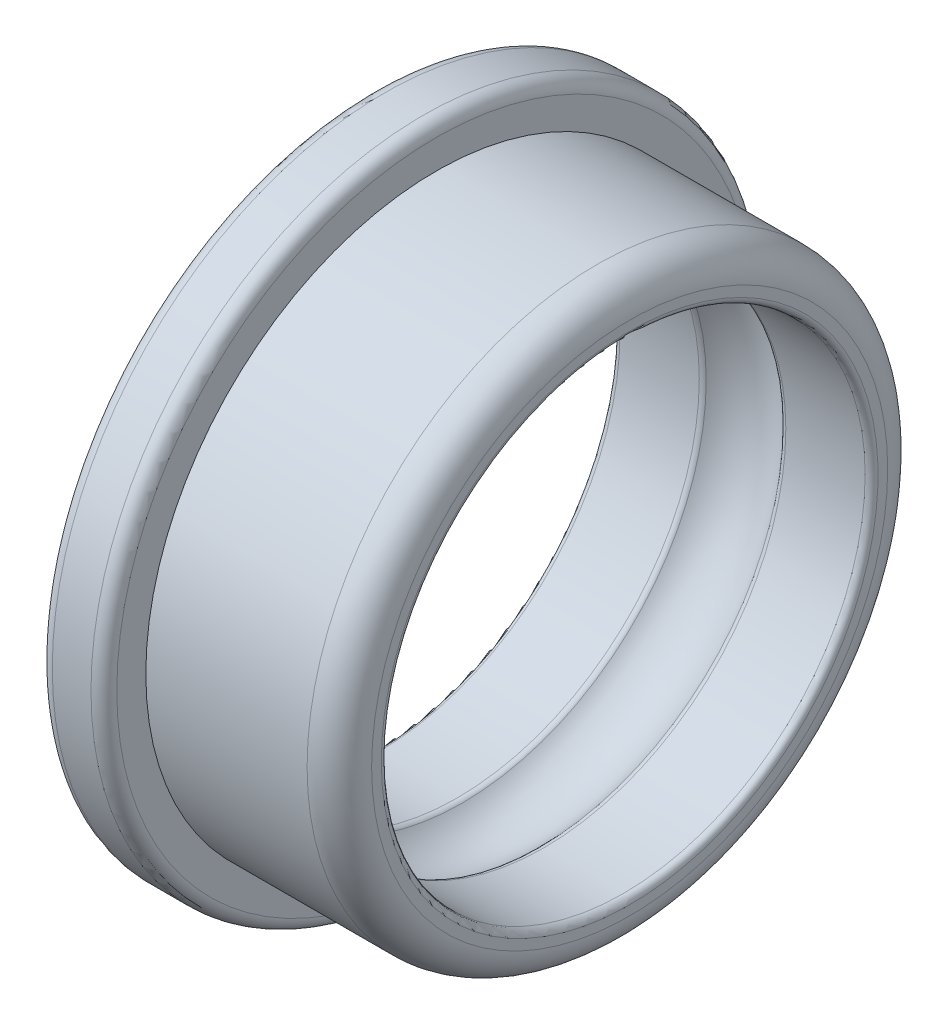
from build123d import *

# Parameters (mm, degrees)
FILLET1_R    = 5
FILLET2_R    = 1
FILLET3_R    = 2
SCALE1_SCALE = 0.1


with BuildPart() as part:
    # Sketch1 → Revolve1 (revolve)
    with BuildSketch(Plane.XY, mode=Mode.PRIVATE) as revolve1_sk:
        with BuildLine():
            Line((-10, 45), (20, 45))
            Line((20, 45), (20, 37.5))
            Line((20, 37.5), (6.244997998, 37.5))
            ThreePointArc((6.244997998, 37.5), (0, 40.5), (-6.244997998, 37.5))
            Line((-6.244997998, 37.5), (-20, 37.5))
            Line((-20, 37.5), (-20, 45))
            Line((-20, 45), (-20, 51.5))
            Line((-20, 51.5), (-10, 51.5))
            Line((-10, 51.5), (-10, 45))
        make_face()
    revolve(revolve1_sk.sketch.rotate(Axis((-66.695068513, 0, 0), (1, 0, 0)), 90), axis=Axis((-66.695068513, 0, 0), (1, 0, 0)))

    # Fillet1
    fillet1_edges = [part.edges().sort_by_distance(p)[0] for p in [
        (20, 0, -45),
    ]]
    fillet(fillet1_edges, radius=FILLET1_R)

    # Fillet2
    fillet2_edges = [part.edges().sort_by_distance(p)[0] for p in [
        (-20, 0, -37.5),
        (-6.244997998, 0, -37.5),
        (6.244997998, 0, -37.5),
        (20, 0, -37.5),
    ]]
    fillet(fillet2_edges, radius=FILLET2_R)

    # Fillet3
    fillet3_edges = [part.edges().sort_by_distance(p)[0] for p in [
        (-10, 0, -51.5),
        (-20, 0, -51.5),
    ]]
    fillet(fillet3_edges, radius=FILLET3_R)


with BuildPart() as part_1:
    # Scale1: scaled about (-3.543396942, 0, 7e-08)
    add(part.part.scale(SCALE1_SCALE).moved(Location((-3.189057248, 0, 6.3e-08))))


solid = part_1.part
